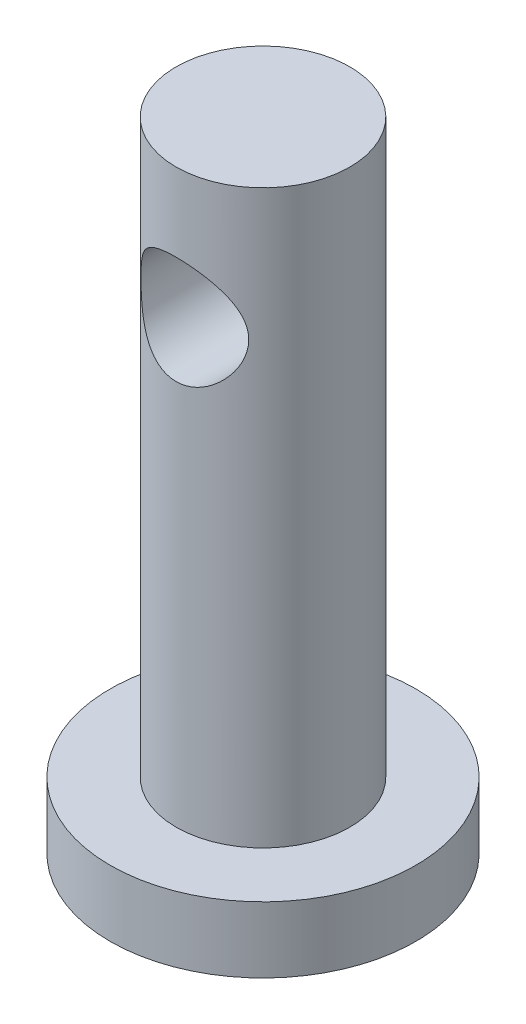
from build123d import *

# Parameters (mm, degrees)
SKETCH1_R               = 3.95
BOSS_EXTRUDE1_DEPTH     = 26
CUT_EXTRUDE1_DEPTH      = 27.59332623
CUT_EXTRUDE1_DEPTH_BACK = 27.59332623
SKETCH2_R               = 2.45
SKETCH3_R               = 6.95
BOSS_EXTRUDE2_DEPTH     = 3


with BuildPart() as part:
    # Sketch1 → Boss-Extrude1 (new body)
    with BuildSketch(Plane(origin=(0, 0, 0), x_dir=(1, 0, 0), z_dir=(0, 1, 0))):
        with Locations(Location((0, 0, 0), (0, 0, 270))):
            Circle(SKETCH1_R)
    extrude(amount=BOSS_EXTRUDE1_DEPTH)

    # Sketch2 → Cut-Extrude1 (cut, two sides: drawn at the far end of the back side and taken through both)
    with BuildSketch(Plane.XY.offset(-CUT_EXTRUDE1_DEPTH_BACK)):
        with Locations((0, 20)):
            Circle(SKETCH2_R)
    extrude(amount=CUT_EXTRUDE1_DEPTH + CUT_EXTRUDE1_DEPTH_BACK, mode=Mode.SUBTRACT)

    # Sketch3 → Boss-Extrude2 (add)
    with BuildSketch(Plane.XZ):
        with Locations(Location((0, 0, 0), (0, 0, 270))):
            Circle(SKETCH3_R)
    extrude(amount=BOSS_EXTRUDE2_DEPTH)


solid = part.part
